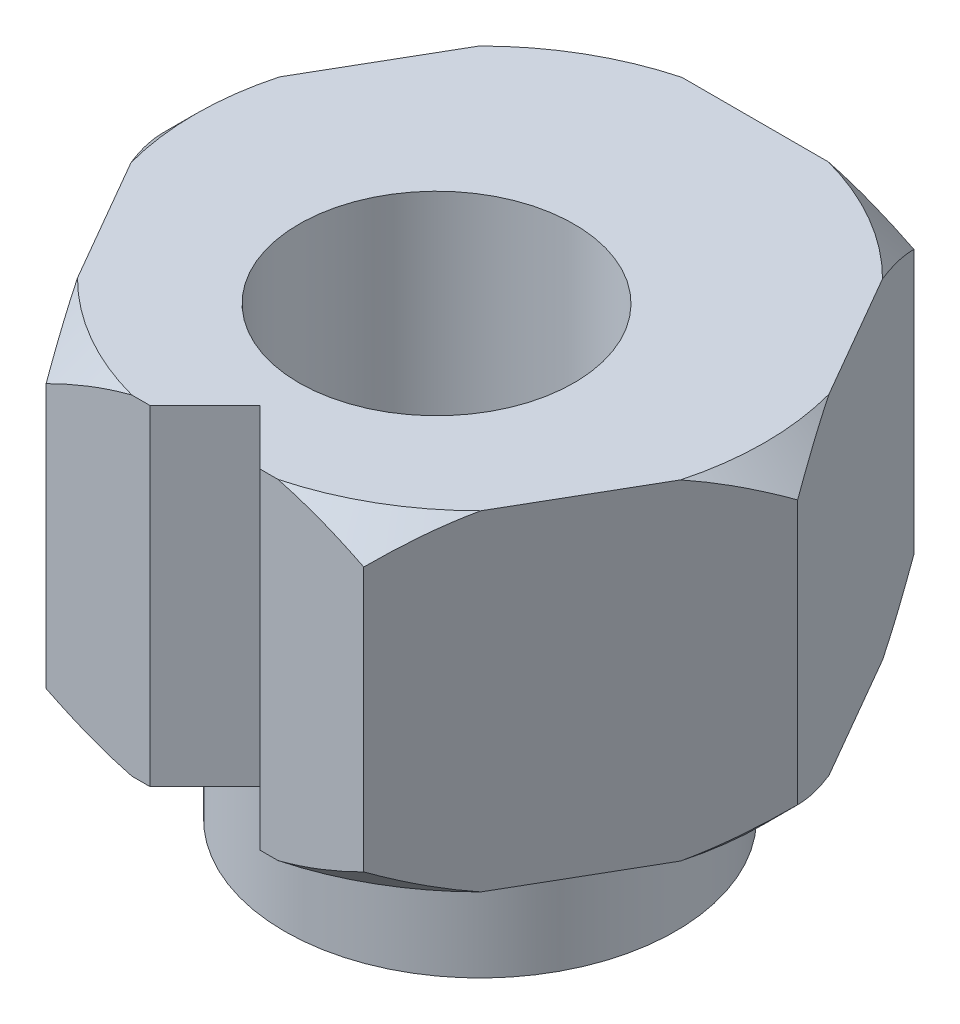
from build123d import *

# Parameters (mm, degrees)
BOSS_EXTRUDE1_DEPTH = 6
SKETCH3_R           = 3.555
BOSS_EXTRUDE3_DEPTH = 2.5
SKETCH4_R           = 2.5
CUT_EXTRUDE1_DEPTH  = 12.427306478
CUT_EXTRUDE2_DEPTH  = 10.712534856


with BuildPart() as part:
    # Sketch1 → Boss-Extrude1 (new body)
    with BuildSketch(Plane(origin=(0, 0, 0), x_dir=(1, 0, 0), z_dir=(0, 1, 0))):
        Polygon((5.773502692, 0), (2.886751346, 5), (-2.886751346, 5), (-5.773502692, 0), (-2.886751346, -5), (2.886751346, -5), align=None)
    extrude(amount=BOSS_EXTRUDE1_DEPTH)

    # Sketch3 → Boss-Extrude3 (add)
    with BuildSketch(Plane.XZ):
        with Locations(Location((0, 0, 0), (0, 0, 90))):
            Circle(SKETCH3_R)
    extrude(amount=BOSS_EXTRUDE3_DEPTH)

    # Sketch4 → Cut-Extrude1 (cut, through all)
    with BuildSketch(Plane(origin=(0, 6, 0), x_dir=(1, 0, 0), z_dir=(0, 1, 0))):
        with Locations(Location((0, -0.79, 0), (0, 0, 270))):
            Circle(SKETCH4_R)
    extrude(amount=-CUT_EXTRUDE1_DEPTH, mode=Mode.SUBTRACT)

    # Sketch5 → Cut-Extrude2 (cut, through all)
    with BuildSketch(Plane(origin=(0, 0, 0), x_dir=(-1, 0, 0), z_dir=(0, -1, 0))):
        Polygon((-1, -5), (1, -5), (0, -4), align=None)
    extrude(amount=-CUT_EXTRUDE2_DEPTH, mode=Mode.SUBTRACT)

    # Sketch6 → Cut-Revolve1 (revolve, cut)
    with BuildSketch(Plane.XY):
        Polygon((5.173502692, 6), (5.773502692, 6), (5.773502692, 5.4), align=None)
        Polygon((5.773502692, 0.6), (5.173502692, 0), (5.773502692, 0), align=None)
    revolve(axis=Axis((0, 0, 0), (0, 1, 0)), mode=Mode.SUBTRACT)


solid = part.part
